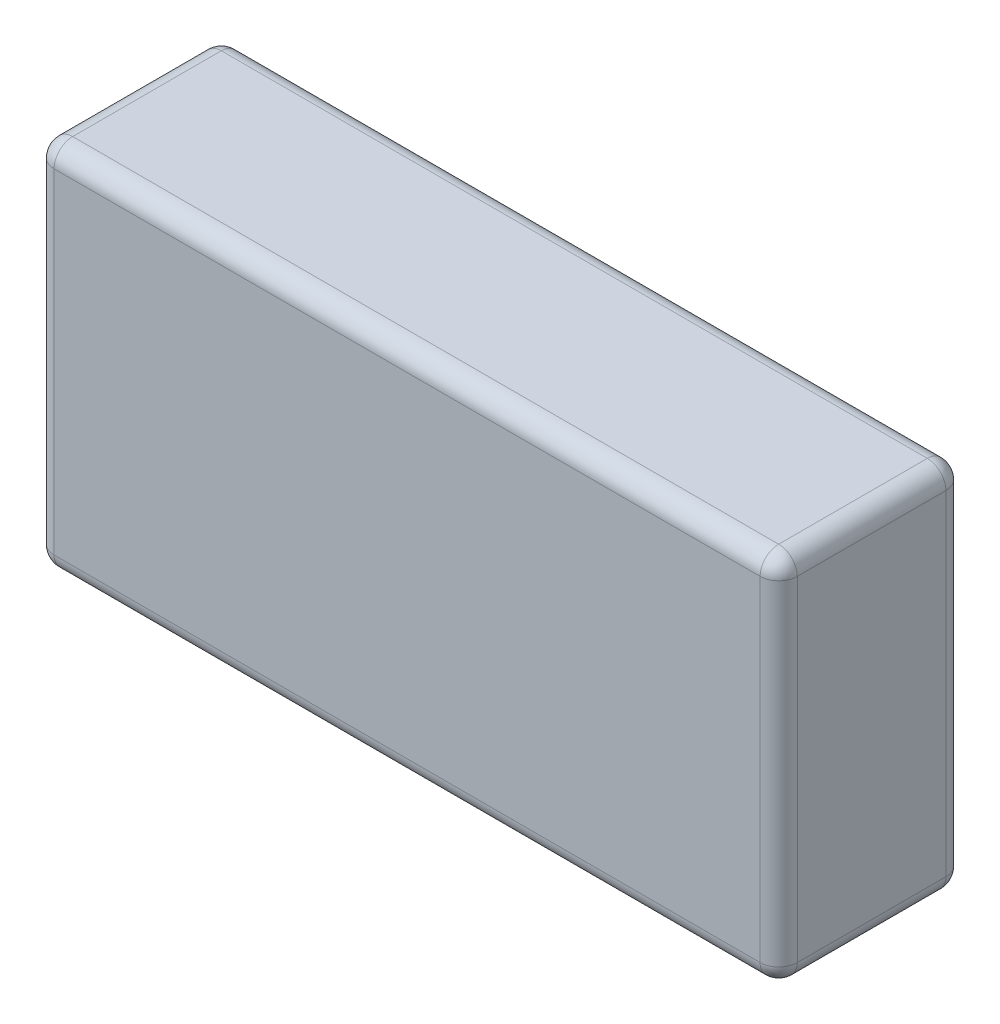
from build123d import *

# Parameters (mm, degrees)
ESBO_O1_W                = 200
ESBO_O1_H                = 50
RESSALTO_EXTRUS_O1_DEPTH = 100
FILETE8_R                = 5


with BuildPart() as part:
    # Esboço1 → Ressalto-extrusão1 (new body)
    with BuildSketch(Plane(origin=(0, 0, 0), x_dir=(1, 0, 0), z_dir=(0, 1, 0))):
        with Locations((45.947958133, -1.570526198)):
            Rectangle(ESBO_O1_W, ESBO_O1_H)
    extrude(amount=RESSALTO_EXTRUS_O1_DEPTH)

    # Filete8
    filete8_edges = [part.edges().sort_by_distance(p)[0] for p in [
        (145.947958133, 100, 1.570526198),
        (45.947958133, 100, -23.429473802),
        (-54.052041867, 100, 1.570526198),
        (45.947958133, 0, -23.429473802),
        (145.947958133, 0, 1.570526198),
        (45.947958133, 0, 26.570526198),
        (-54.052041867, 0, 1.570526198),
        (45.947958133, 100, 26.570526198),
        (-54.052041867, 50, -23.429473802),
        (145.947958133, 50, -23.429473802),
        (145.947958133, 50, 26.570526198),
        (-54.052041867, 50, 26.570526198),
    ]]
    fillet(filete8_edges, radius=FILETE8_R)


solid = part.part
